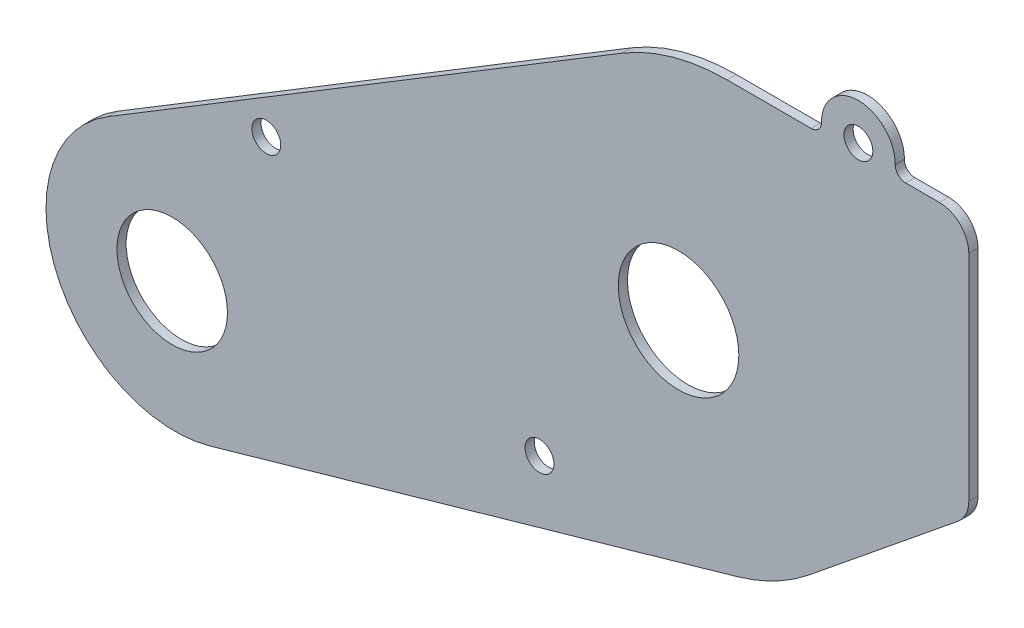
from build123d import *

# Parameters (mm, degrees)
SKETCH2_R              = 10.387693019
SKETCH2_R_2            = 9.525
BOSS_EXTRUDE1_DEPTH    = 1.5875
F_10_CLEARANCE_HOLE1_D = 4.9784


with BuildPart() as part:
    # Sketch2 → Boss-Extrude1 (new body)
    with BuildSketch(Plane.XY):
        with BuildLine():
            Line((25.091057906, -52.092444741), (-65.683756135, -78.000081372))
            ThreePointArc((-65.683756135, -78.000081372), (-92.150845981, -65.52313309), (-83.314246567, -37.628768173))
            Line((-83.314246567, -37.628768173), (5.271270971, 16.133758159))
            ThreePointArc((5.271270971, 16.133758159), (13.983534085, 19.911144202), (23.391278089, 21.202084415))
            Line((23.391278089, 21.202084415), (37.879087429, 21.202084415))
            ThreePointArc((37.879087429, 21.202084415), (39.136323286, 21.722848558), (39.657087429, 22.980084415))
            Line((39.657087429, 22.980084415), (39.657087429, 23.085322173))
            ThreePointArc((39.657087429, 23.085322173), (46.007087429, 29.435322173), (52.357087429, 23.085322173))
            Line((52.357087429, 23.085322173), (52.357087429, 22.980084415))
            ThreePointArc((52.357087429, 22.980084415), (52.877851572, 21.722848558), (54.135087429, 21.202084415))
            Line((54.135087429, 21.202084415), (59.957258632, 21.202084415))
            ThreePointArc((59.957258632, 21.202084415), (63.54936108, 19.714186863), (65.037258632, 16.122084415))
            Line((65.037258632, 16.122084415), (65.037258632, -20.861923216))
            ThreePointArc((65.037258632, -20.861923216), (64.543779313, -23.046008387), (63.159216098, -24.805762511))
            Line((63.159216098, -24.805762511), (37.51946621, -45.622378614))
            ThreePointArc((37.51946621, -45.622378614), (31.63306192, -49.487085384), (25.091057906, -52.092444741))
        make_face()
        with Locations((15.016809712, -18.87461968)):
            Circle(SKETCH2_R, mode=Mode.SUBTRACT)
        with Locations((-72.258332946, -56.628468385)):
            Circle(SKETCH2_R_2, mode=Mode.SUBTRACT)
    extrude(amount=BOSS_EXTRUDE1_DEPTH)

    # #10 Clearance Hole1 (through all)
    with Locations(Plane.XY.offset(1.5875)):
        with Locations((-56.041369259, -27.019222928), (-8.951277081, -51.090630662), (46.007087429, 23.085322173)):
            Hole(F_10_CLEARANCE_HOLE1_D / 2)


solid = part.part
